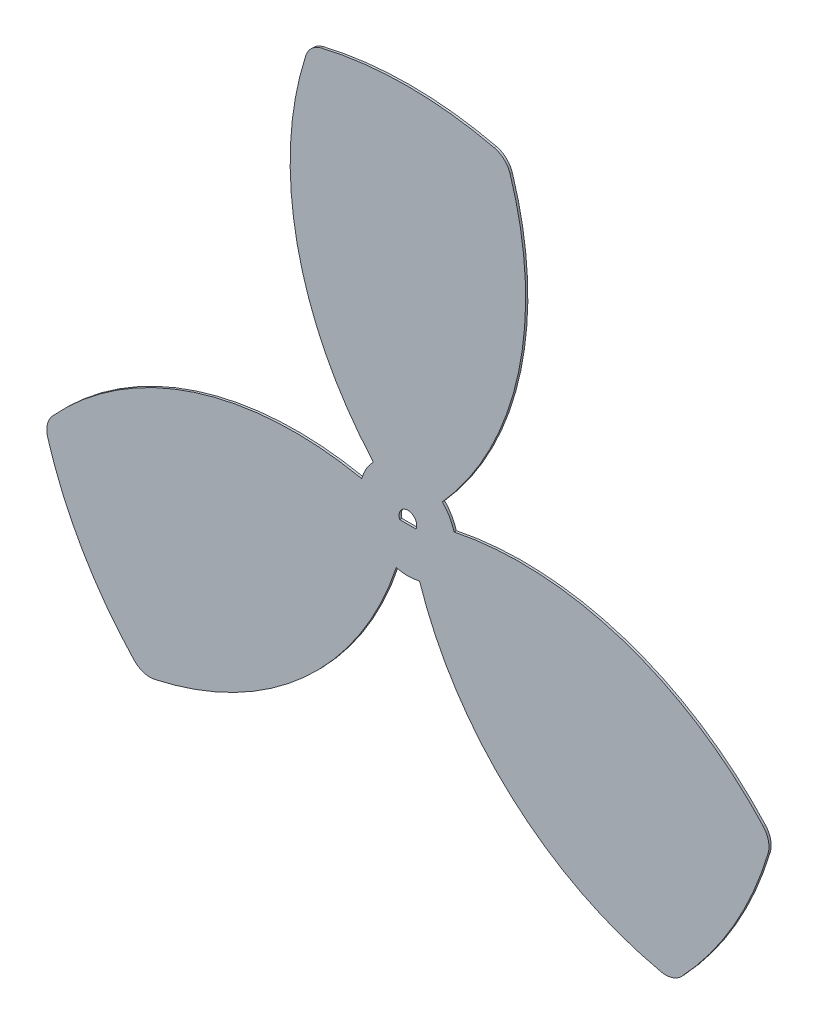
from build123d import *

# Parameters (mm, degrees)
ESQUISSE2_R             = 21.716757685
BOSS_EXTRU_1_DEPTH      = 1
ENL_V_MAT_EXTRU_2_DEPTH = 293.837814183
CONG_2_R                = 10


with BuildPart() as part:
    # Esquisse2 → Boss.-Extru.1 (new body)
    with BuildSketch(Plane.XY):
        with Locations((-43.22899501, 36.585487108)):
            Circle(ESQUISSE2_R)
        with BuildLine():
            ThreePointArc((-207.546192285, -7.001881243), (-132.259115873, 40.696309579), (-43.22899501, 36.585487108))
            ThreePointArc((-43.22899501, 36.585487108), (-84.183978752, -42.572270496), (-163.135361924, -83.923695834))
            ThreePointArc((-163.135361924, -83.923695834), (-190.453313653, -48.414512892), (-207.546192285, -7.001881243))
        make_face()
        with BuildLine():
            ThreePointArc((76.677371904, -83.923695834), (-2.274011269, -42.572270496), (-43.22899501, 36.585487108))
            ThreePointArc((-43.22899501, 36.585487108), (45.801125853, 40.696309579), (121.088202265, -7.001881243))
            ThreePointArc((121.088202265, -7.001881243), (103.995323633, -48.414512892), (76.677371904, -83.923695834))
        make_face()
        with BuildLine():
            Line((-43.22899501, 206.585487108), (-43.22899501, 58.302244794))
            ThreePointArc((-43.22899501, 58.302244794), (-34.753748483, 56.580180421), (-27.622617897, 51.687094896))
            ThreePointArc((-27.622617897, 51.687094896), (7.298277527, 122.217794206), (1.181835351, 200.682038403))
            ThreePointArc((1.181835351, 200.682038403), (-20.82825529, 205.103162324), (-43.22899501, 206.585487108))
        make_face()
        with BuildLine():
            ThreePointArc((-58.835372123, 51.687094896), (-51.704241537, 56.580180421), (-43.22899501, 58.302244794))
            Line((-43.22899501, 58.302244794), (-43.22899501, 206.585487108))
            ThreePointArc((-43.22899501, 206.585487108), (-65.62973473, 205.103162324), (-87.639825371, 200.682038403))
            ThreePointArc((-87.639825371, 200.682038403), (-93.756267547, 122.217794206), (-58.835372123, 51.687094896))
        make_face()
        with BuildLine():
            ThreePointArc((-48.504182436, 15.519164174), (-45.480177087, 25.955564863), (-43.22899501, 36.585487108))
            ThreePointArc((-43.22899501, 36.585487108), (-53.560368754, 39.950867364), (-64.110559549, 42.550202255))
            ThreePointArc((-64.110559549, 42.550202255), (-62.036258854, 25.727108266), (-48.504182436, 15.519164174))
        make_face()
        with BuildLine():
            ThreePointArc((-22.347430471, 42.550202255), (-32.897621267, 39.950867364), (-43.22899501, 36.585487108))
            ThreePointArc((-43.22899501, 36.585487108), (-40.977812933, 25.955564863), (-37.953807584, 15.519164174))
            ThreePointArc((-37.953807584, 15.519164174), (-26.109159563, 23.224020174), (-21.512237325, 36.585487108))
            ThreePointArc((-21.512237325, 36.585487108), (-21.722049137, 39.596939182), (-22.347430471, 42.550202255))
        make_face()
        with BuildLine():
            ThreePointArc((-37.953807584, 15.519164174), (-40.977812933, 25.955564863), (-43.22899501, 36.585487108))
            ThreePointArc((-43.22899501, 36.585487108), (-45.480177087, 25.955564863), (-48.504182436, 15.519164174))
            ThreePointArc((-48.504182436, 15.519164174), (-43.22899501, 14.868729423), (-37.953807584, 15.519164174))
        make_face()
        with BuildLine():
            ThreePointArc((-64.110559549, 42.550202255), (-53.560368754, 39.950867364), (-43.22899501, 36.585487108))
            ThreePointArc((-43.22899501, 36.585487108), (-51.309186676, 43.850029099), (-58.835372123, 51.687094896))
            ThreePointArc((-58.835372123, 51.687094896), (-62.036258854, 47.443865951), (-64.110559549, 42.550202255))
        make_face()
        with BuildLine():
            ThreePointArc((-58.835372123, 51.687094896), (-51.309186676, 43.850029099), (-43.22899501, 36.585487108))
            Line((-43.22899501, 36.585487108), (-43.22899501, 58.302244794))
            ThreePointArc((-43.22899501, 58.302244794), (-51.704241537, 56.580180421), (-58.835372123, 51.687094896))
        make_face()
        with BuildLine():
            Line((-43.22899501, 58.302244794), (-43.22899501, 36.585487108))
            ThreePointArc((-43.22899501, 36.585487108), (-35.148803344, 43.850029099), (-27.622617897, 51.687094896))
            ThreePointArc((-27.622617897, 51.687094896), (-34.753748483, 56.580180421), (-43.22899501, 58.302244794))
        make_face()
        with BuildLine():
            ThreePointArc((-27.622617897, 51.687094896), (-35.148803344, 43.850029099), (-43.22899501, 36.585487108))
            ThreePointArc((-43.22899501, 36.585487108), (-32.897621267, 39.950867364), (-22.347430471, 42.550202255))
            ThreePointArc((-22.347430471, 42.550202255), (-24.421731167, 47.443865951), (-27.622617897, 51.687094896))
        make_face()
    extrude(amount=BOSS_EXTRU_1_DEPTH)

    # Esquisse4 → Enlèv. mat.-Extru.2 (cut, through all)
    with BuildSketch(Plane(origin=(0, 0, 0), x_dir=(-1, 0, 0), z_dir=(0, 0, -1))):
        with BuildLine():
            Line((46.937094254, 35.085487108), (39.520895767, 35.085487108))
            ThreePointArc((39.520895767, 35.085487108), (43.22899501, 40.585487108), (46.937094254, 35.085487108))
        make_face()
    extrude(amount=-ENL_V_MAT_EXTRU_2_DEPTH, mode=Mode.SUBTRACT)

    # Congé2
    cong_2_edges = [part.edges().sort_by_distance(p)[0] for p in [
        (-87.639825371, 200.682038403, 0.5),
        (1.181835351, 200.682038403, 0.5),
        (121.088202265, -7.001881243, 0.5),
        (76.677371904, -83.923695834, 0.5),
        (-163.135361924, -83.923695834, 0.5),
        (-207.546192285, -7.001881243, 0.5),
    ]]
    fillet(cong_2_edges, radius=CONG_2_R)


solid = part.part
